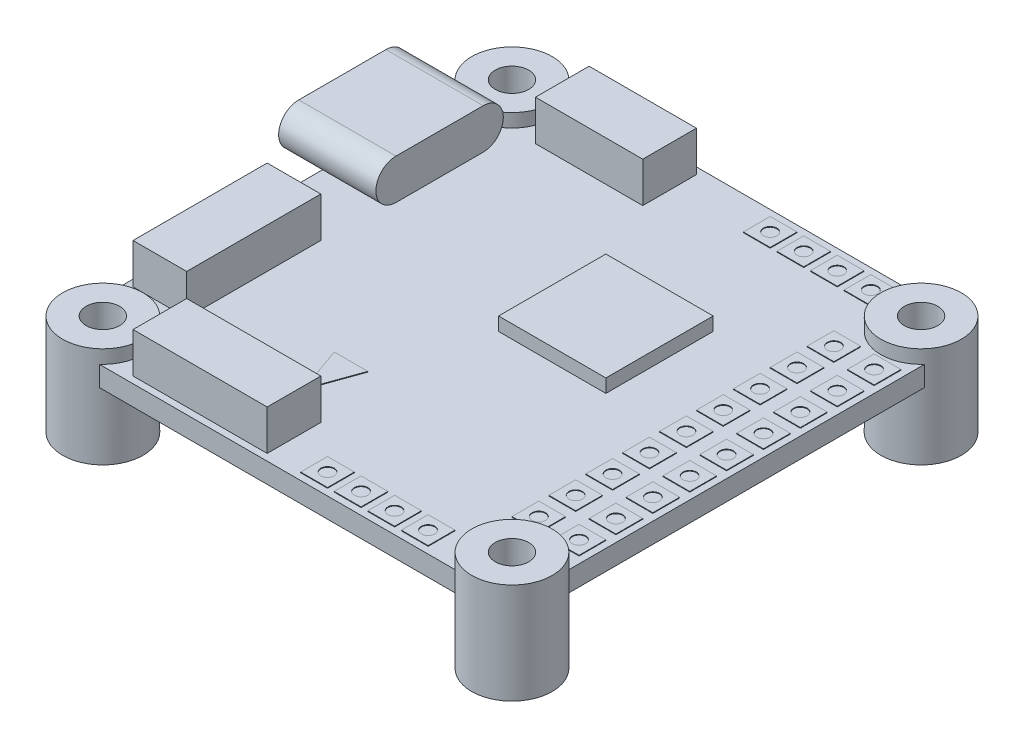
from build123d import *

# Parameters (mm, degrees)
BOSS_EXTRUDE1_DEPTH        = 1.5
BOSS_EXTRUDE2_DEPTH        = 1
BOSS_EXTRUDE2_DEPTH_BACK   = 6.5
SKETCH2_R                  = 3
CUT_EXTRUDE1_DEPTH         = 27.877035
CUT_EXTRUDE1_DEPTH_BACK    = 27.877035
SKETCH3_R                  = 1.25
SKETCH4_W                  = 8
SKETCH4_H                  = 4
SKETCH4_W_2                = 4
SKETCH4_H_2                = 10
SKETCH4_W_3                = 10
BOSS_EXTRUDE3_DEPTH        = 3
SKETCH5_W                  = 8
SKETCH5_H                  = 8
BOSS_EXTRUDE4_DEPTH        = 1
BOSS_EXTRUDE5_DEPTH        = 2
BOSS_EXTRUDE5_DEPTH_BACK   = 5
BOSS_EXTRUDE5_2_DEPTH      = 2
BOSS_EXTRUDE5_2_DEPTH_BACK = 5
BOSS_EXTRUDE6_DEPTH        = 0.25
BOSS_EXTRUDE7_DEPTH        = 0.05
SKETCH9_W                  = 2
SKETCH9_H                  = 2
SKETCH9_R                  = 0.5
BOSS_EXTRUDE8_DEPTH        = 0.05


with BuildPart() as part:
    # Sketch1 → Boss-Extrude1 (new body)
    with BuildSketch(Plane(origin=(0, 0, 0), x_dir=(1, 0, 0), z_dir=(0, 1, 0))):
        with BuildLine():
            Line((-13.265687, 17.5), (13.265687, 17.5))
            ThreePointArc((13.265687, 17.5), (17.37132, 17.37132), (17.5, 13.265687))
            Line((17.5, 13.265687), (17.5, -13.265687))
            ThreePointArc((17.5, -13.265687), (17.37132, -17.37132), (13.265687, -17.5))
            Line((13.265687, -17.5), (-13.265687, -17.5))
            ThreePointArc((-13.265687, -17.5), (-17.37132, -17.37132), (-17.5, -13.265687))
            Line((-17.5, -13.265687), (-17.5, 13.265687))
            ThreePointArc((-17.5, 13.265687), (-17.37132, 17.37132), (-13.265687, 17.5))
        make_face()
    extrude(amount=BOSS_EXTRUDE1_DEPTH)

    # Sketch2 → Boss-Extrude2 (add, two sides: drawn at the far end of the back side and taken through both)
    with BuildSketch(Plane(origin=(0, 1.5, 0), x_dir=(1, 0, 0), z_dir=(0, 1, 0)).offset(-BOSS_EXTRUDE2_DEPTH_BACK)):
        with Locations(Location((-15.25, 15.25, 0), (0, 0, 270))):
            Circle(SKETCH2_R)
        with Locations(Location((15.25, 15.25, 0), (0, 0, 270))):
            Circle(SKETCH2_R)
        with Locations(Location((15.25, -15.25, 0), (0, 0, 270))):
            Circle(SKETCH2_R)
        with Locations(Location((-15.25, -15.25, 0), (0, 0, 270))):
            Circle(SKETCH2_R)
    extrude(amount=BOSS_EXTRUDE2_DEPTH + BOSS_EXTRUDE2_DEPTH_BACK)

    # Sketch3 → Cut-Extrude1 (cut, two sides: drawn at the far end of the back side and taken through both)
    with BuildSketch(Plane(origin=(0, 2.5, 0), x_dir=(1, 0, 0), z_dir=(0, 1, 0)).offset(-CUT_EXTRUDE1_DEPTH_BACK)):
        with Locations(Location((-15.25, -15.25, 0), (0, 0, 270))):
            Circle(SKETCH3_R)
        with Locations(Location((-15.25, 15.25, 0), (0, 0, 270))):
            Circle(SKETCH3_R)
        with Locations(Location((15.25, 15.25, 0), (0, 0, 270))):
            Circle(SKETCH3_R)
        with Locations(Location((15.25, -15.25, 0), (0, 0, 270))):
            Circle(SKETCH3_R)
    extrude(amount=CUT_EXTRUDE1_DEPTH + CUT_EXTRUDE1_DEPTH_BACK, mode=Mode.SUBTRACT)

    # Sketch4 → Boss-Extrude3 (add)
    with BuildSketch(Plane(origin=(0, 1.5, 0), x_dir=(1, 0, 0), z_dir=(0, 1, 0))):
        with Locations((-7.25, 15)):
            Rectangle(SKETCH4_W, SKETCH4_H)
        with Locations((-15, -6.25)):
            Rectangle(SKETCH4_W_2, SKETCH4_H_2)
        with Locations((-6.25, -15)):
            Rectangle(SKETCH4_W_3, SKETCH4_H)
    extrude(amount=BOSS_EXTRUDE3_DEPTH)

    # Sketch5 → Boss-Extrude4 (add)
    with BuildSketch(Plane(origin=(0, 1.5, 0), x_dir=(1, 0, 0), z_dir=(0, 1, 0))):
        with Locations((3.5, 3.5)):
            Rectangle(SKETCH5_W, SKETCH5_H)
    extrude(amount=BOSS_EXTRUDE4_DEPTH)

    # Sketch8 → Boss-Extrude7 (add)
    with BuildSketch(Plane(origin=(0, 1.5, 0), x_dir=(1, 0, 0), z_dir=(0, 1, 0))):
        Polygon((-5.25, -8), (-4, -11.5), (-2.75, -8), align=None)
    extrude(amount=BOSS_EXTRUDE7_DEPTH)

    # Sketch9 → Boss-Extrude8 (add)
    # profile 1 of 26: a face of its own
    with BuildSketch(Plane(origin=(0, 1.5, 0), x_dir=(1, 0, 0), z_dir=(0, 1, 0))):
        with Locations((2.25, -16)):
            Rectangle(SKETCH9_W, SKETCH9_H)
        with Locations(Location((2.25, -16, 0), (0, 0, 270))):
            Circle(SKETCH9_R, mode=Mode.SUBTRACT)
    # profile 2 of 26: a face of its own
    with BuildSketch(Plane(origin=(0, 1.5, 0), x_dir=(1, 0, 0), z_dir=(0, 1, 0))):
        with Locations((4.75, -16)):
            Rectangle(SKETCH9_W, SKETCH9_H)
        with Locations(Location((4.75, -16, 0), (0, 0, 270))):
            Circle(SKETCH9_R, mode=Mode.SUBTRACT)
    # profile 3 of 26: a face of its own
    with BuildSketch(Plane(origin=(0, 1.5, 0), x_dir=(1, 0, 0), z_dir=(0, 1, 0))):
        with Locations((7.25, -16)):
            Rectangle(SKETCH9_W, SKETCH9_H)
        with Locations(Location((7.25, -16, 0), (0, 0, 270))):
            Circle(SKETCH9_R, mode=Mode.SUBTRACT)
    # profile 4 of 26: a face of its own
    with BuildSketch(Plane(origin=(0, 1.5, 0), x_dir=(1, 0, 0), z_dir=(0, 1, 0))):
        with Locations((9.75, -16)):
            Rectangle(SKETCH9_W, SKETCH9_H)
        with Locations(Location((9.75, -16, 0), (0, 0, 270))):
            Circle(SKETCH9_R, mode=Mode.SUBTRACT)
    # profile 5 of 26: a face of its own
    with BuildSketch(Plane(origin=(0, 1.5, 0), x_dir=(1, 0, 0), z_dir=(0, 1, 0))):
        with Locations((16, 11)):
            Rectangle(SKETCH9_W, SKETCH9_H)
        with Locations(Location((16, 11, 0), (0, 0, 270))):
            Circle(SKETCH9_R, mode=Mode.SUBTRACT)
    # profile 6 of 26: a face of its own
    with BuildSketch(Plane(origin=(0, 1.5, 0), x_dir=(1, 0, 0), z_dir=(0, 1, 0))):
        with Locations((13, 11)):
            Rectangle(SKETCH9_W, SKETCH9_H)
        with Locations(Location((13, 11, 0), (0, 0, 270))):
            Circle(SKETCH9_R, mode=Mode.SUBTRACT)
    # profile 7 of 26: a face of its own
    with BuildSketch(Plane(origin=(0, 1.5, 0), x_dir=(1, 0, 0), z_dir=(0, 1, 0))):
        with Locations((16, 5.5)):
            Rectangle(SKETCH9_W, SKETCH9_H)
        with Locations(Location((16, 5.5, 0), (0, 0, 270))):
            Circle(SKETCH9_R, mode=Mode.SUBTRACT)
    # profile 8 of 26: a face of its own
    with BuildSketch(Plane(origin=(0, 1.5, 0), x_dir=(1, 0, 0), z_dir=(0, 1, 0))):
        with Locations((13, 5.5)):
            Rectangle(SKETCH9_W, SKETCH9_H)
        with Locations(Location((13, 5.5, 0), (0, 0, 270))):
            Circle(SKETCH9_R, mode=Mode.SUBTRACT)
    # profile 9 of 26: a face of its own
    with BuildSketch(Plane(origin=(0, 1.5, 0), x_dir=(1, 0, 0), z_dir=(0, 1, 0))):
        with Locations((16, 2.75)):
            Rectangle(SKETCH9_W, SKETCH9_H)
        with Locations(Location((16, 2.75, 0), (0, 0, 270))):
            Circle(SKETCH9_R, mode=Mode.SUBTRACT)
    # profile 10 of 26: a face of its own
    with BuildSketch(Plane(origin=(0, 1.5, 0), x_dir=(1, 0, 0), z_dir=(0, 1, 0))):
        with Locations((13, 2.75)):
            Rectangle(SKETCH9_W, SKETCH9_H)
        with Locations(Location((13, 2.75, 0), (0, 0, 270))):
            Circle(SKETCH9_R, mode=Mode.SUBTRACT)
    # profile 11 of 26: a face of its own
    with BuildSketch(Plane(origin=(0, 1.5, 0), x_dir=(1, 0, 0), z_dir=(0, 1, 0))):
        with Locations((16, 8.25)):
            Rectangle(SKETCH9_W, SKETCH9_H)
        with Locations(Location((16, 8.25, 0), (0, 0, 270))):
            Circle(SKETCH9_R, mode=Mode.SUBTRACT)
    # profile 12 of 26: a face of its own
    with BuildSketch(Plane(origin=(0, 1.5, 0), x_dir=(1, 0, 0), z_dir=(0, 1, 0))):
        with Locations((13, 8.25)):
            Rectangle(SKETCH9_W, SKETCH9_H)
        with Locations(Location((13, 8.25, 0), (0, 0, 270))):
            Circle(SKETCH9_R, mode=Mode.SUBTRACT)
    # profile 13 of 26: a face of its own
    with BuildSketch(Plane(origin=(0, 1.5, 0), x_dir=(1, 0, 0), z_dir=(0, 1, 0))):
        with Locations((16, 0)):
            Rectangle(SKETCH9_W, SKETCH9_H)
        with Locations(Location((16, 0, 0), (0, 0, 270))):
            Circle(SKETCH9_R, mode=Mode.SUBTRACT)
    # profile 14 of 26: a face of its own
    with BuildSketch(Plane(origin=(0, 1.5, 0), x_dir=(1, 0, 0), z_dir=(0, 1, 0))):
        with Locations((13, 0)):
            Rectangle(SKETCH9_W, SKETCH9_H)
        with Locations(Location((13, 0, 0), (0, 0, 270))):
            Circle(SKETCH9_R, mode=Mode.SUBTRACT)
    # profile 15 of 26: a face of its own
    with BuildSketch(Plane(origin=(0, 1.5, 0), x_dir=(1, 0, 0), z_dir=(0, 1, 0))):
        with Locations((16, -2.75)):
            Rectangle(SKETCH9_W, SKETCH9_H)
        with Locations(Location((16, -2.75, 0), (0, 0, 270))):
            Circle(SKETCH9_R, mode=Mode.SUBTRACT)
    # profile 16 of 26: a face of its own
    with BuildSketch(Plane(origin=(0, 1.5, 0), x_dir=(1, 0, 0), z_dir=(0, 1, 0))):
        with Locations((13, -2.75)):
            Rectangle(SKETCH9_W, SKETCH9_H)
        with Locations(Location((13, -2.75, 0), (0, 0, 270))):
            Circle(SKETCH9_R, mode=Mode.SUBTRACT)
    # profile 17 of 26: a face of its own
    with BuildSketch(Plane(origin=(0, 1.5, 0), x_dir=(1, 0, 0), z_dir=(0, 1, 0))):
        with Locations((16, -5.5)):
            Rectangle(SKETCH9_W, SKETCH9_H)
        with Locations(Location((16, -5.5, 0), (0, 0, 270))):
            Circle(SKETCH9_R, mode=Mode.SUBTRACT)
    # profile 18 of 26: a face of its own
    with BuildSketch(Plane(origin=(0, 1.5, 0), x_dir=(1, 0, 0), z_dir=(0, 1, 0))):
        with Locations((13, -5.5)):
            Rectangle(SKETCH9_W, SKETCH9_H)
        with Locations(Location((13, -5.5, 0), (0, 0, 270))):
            Circle(SKETCH9_R, mode=Mode.SUBTRACT)
    # profile 19 of 26: a face of its own
    with BuildSketch(Plane(origin=(0, 1.5, 0), x_dir=(1, 0, 0), z_dir=(0, 1, 0))):
        with Locations((16, -8.25)):
            Rectangle(SKETCH9_W, SKETCH9_H)
        with Locations(Location((16, -8.25, 0), (0, 0, 270))):
            Circle(SKETCH9_R, mode=Mode.SUBTRACT)
    # profile 20 of 26: a face of its own
    with BuildSketch(Plane(origin=(0, 1.5, 0), x_dir=(1, 0, 0), z_dir=(0, 1, 0))):
        with Locations((13, -8.25)):
            Rectangle(SKETCH9_W, SKETCH9_H)
        with Locations(Location((13, -8.25, 0), (0, 0, 270))):
            Circle(SKETCH9_R, mode=Mode.SUBTRACT)
    # profile 21 of 26: a face of its own
    with BuildSketch(Plane(origin=(0, 1.5, 0), x_dir=(1, 0, 0), z_dir=(0, 1, 0))):
        with Locations((16, -11)):
            Rectangle(SKETCH9_W, SKETCH9_H)
        with Locations(Location((16, -11, 0), (0, 0, 270))):
            Circle(SKETCH9_R, mode=Mode.SUBTRACT)
    # profile 22 of 26: a face of its own
    with BuildSketch(Plane(origin=(0, 1.5, 0), x_dir=(1, 0, 0), z_dir=(0, 1, 0))):
        with Locations((13, -11)):
            Rectangle(SKETCH9_W, SKETCH9_H)
        with Locations(Location((13, -11, 0), (0, 0, 270))):
            Circle(SKETCH9_R, mode=Mode.SUBTRACT)
    # profile 23 of 26: a face of its own
    with BuildSketch(Plane(origin=(0, 1.5, 0), x_dir=(1, 0, 0), z_dir=(0, 1, 0))):
        with Locations((3.25, 16)):
            Rectangle(SKETCH9_W, SKETCH9_H)
        with Locations(Location((3.25, 16, 0), (0, 0, 270))):
            Circle(SKETCH9_R, mode=Mode.SUBTRACT)
    # profile 24 of 26: a face of its own
    with BuildSketch(Plane(origin=(0, 1.5, 0), x_dir=(1, 0, 0), z_dir=(0, 1, 0))):
        with Locations((5.75, 16)):
            Rectangle(SKETCH9_W, SKETCH9_H)
        with Locations(Location((5.75, 16, 0), (0, 0, 270))):
            Circle(SKETCH9_R, mode=Mode.SUBTRACT)
    # profile 25 of 26: a face of its own
    with BuildSketch(Plane(origin=(0, 1.5, 0), x_dir=(1, 0, 0), z_dir=(0, 1, 0))):
        with Locations((8.25, 16)):
            Rectangle(SKETCH9_W, SKETCH9_H)
        with Locations(Location((8.25, 16, 0), (0, 0, 270))):
            Circle(SKETCH9_R, mode=Mode.SUBTRACT)
    # profile 26 of 26: a face of its own
    with BuildSketch(Plane(origin=(0, 1.5, 0), x_dir=(1, 0, 0), z_dir=(0, 1, 0))):
        with Locations((10.75, 16)):
            Rectangle(SKETCH9_W, SKETCH9_H)
        with Locations(Location((10.75, 16, 0), (0, 0, 270))):
            Circle(SKETCH9_R, mode=Mode.SUBTRACT)
    extrude(amount=BOSS_EXTRUDE8_DEPTH)


with BuildPart() as body_2:
    # Sketch6 → Boss-Extrude5 (new, two sides: drawn at the far end of the back side and taken through both)
    with BuildSketch(Plane.ZY.offset(17.5).offset(-BOSS_EXTRUDE5_DEPTH_BACK)):
        with BuildLine():
            Line((-10.104551, 1.896992), (-3.604551, 1.896992))
            ThreePointArc((-3.604551, 1.896992), (-2.104551, 3.396992), (-3.604551, 4.896992))
            Line((-3.604551, 4.896992), (-10.104551, 4.896992))
            ThreePointArc((-10.104551, 4.896992), (-11.604551, 3.396992), (-10.104551, 1.896992))
        make_face()
        with BuildLine():
            ThreePointArc((-3.604551, 2.146992), (-2.354551, 3.396992), (-3.604551, 4.646992))
            Line((-3.604551, 4.646992), (-10.104551, 4.646992))
            ThreePointArc((-10.104551, 4.646992), (-11.354551, 3.396992), (-10.104551, 2.146992))
            Line((-10.104551, 2.146992), (-3.604551, 2.146992))
        make_face(mode=Mode.SUBTRACT)
    extrude(amount=BOSS_EXTRUDE5_DEPTH + BOSS_EXTRUDE5_DEPTH_BACK)



with BuildPart() as body_3:
    # Sketch6 → Boss-Extrude5 2 (new, two sides: drawn at the far end of the back side and taken through both)
    with BuildSketch(Plane.ZY.offset(17.5).offset(-BOSS_EXTRUDE5_2_DEPTH_BACK)):
        with BuildLine():
            ThreePointArc((-3.954551, 3.521992), (-3.88384, 3.492702), (-3.854551, 3.421992))
            Line((-3.854551, 3.421992), (-3.854551, 3.371992))
            ThreePointArc((-3.854551, 3.371992), (-3.88384, 3.301281), (-3.954551, 3.271992))
            Line((-3.954551, 3.271992), (-9.754551, 3.271992))
            ThreePointArc((-9.754551, 3.271992), (-9.825262, 3.301281), (-9.854551, 3.371992))
            Line((-9.854551, 3.371992), (-9.854551, 3.421992))
            ThreePointArc((-9.854551, 3.421992), (-9.825262, 3.492702), (-9.754551, 3.521992))
            Line((-9.754551, 3.521992), (-3.954551, 3.521992))
        make_face()
    extrude(amount=BOSS_EXTRUDE5_2_DEPTH + BOSS_EXTRUDE5_2_DEPTH_BACK)


with BuildPart() as body_2_1:
    add(body_2.part)

    add(body_3.part)  # Boss-Extrude6 merges body 3
    # Sketch7 → Boss-Extrude6 (add)
    with BuildSketch(Plane(origin=(-12.5, 0, 0), x_dir=(0, 0, -1), z_dir=(1, 0, 0))):
        with BuildLine():
            Line((3.604551, 4.896992), (10.104551, 4.896992))
            ThreePointArc((10.104551, 4.896992), (11.604551, 3.396992), (10.104551, 1.896992))
            Line((10.104551, 1.896992), (3.604551, 1.896992))
            ThreePointArc((3.604551, 1.896992), (2.104551, 3.396992), (3.604551, 4.896992))
        make_face()
    extrude(amount=BOSS_EXTRUDE6_DEPTH)


solid = Compound([part.part, body_2_1.part])
